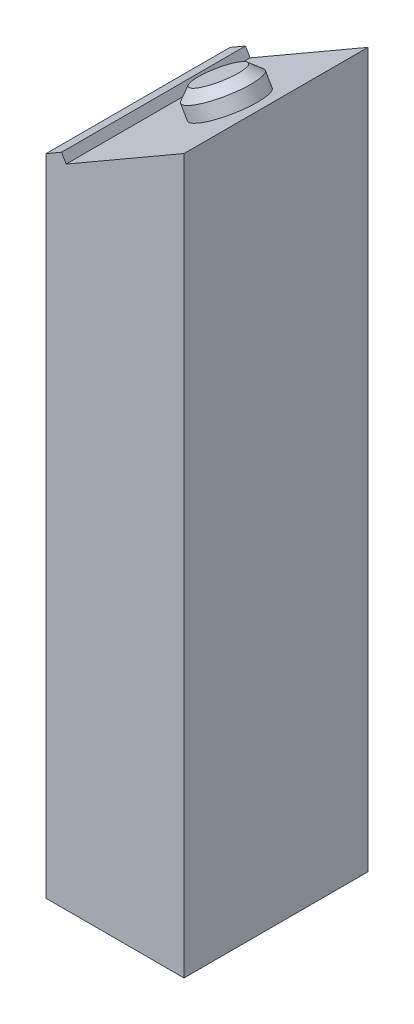
from build123d import *

# Parameters (mm, degrees)
EXTRUDE_1_DEPTH     = 9
SKETCH_2_R          = 3.5
CUT_EXTRUDE_1_DEPTH = 18
EXTRUDE_2_DEPTH     = 10
EXTRUDE_START       = 2.5
SKETCH_4_R          = 3.5
EXTRUDE_3_DEPTH     = 2.5
CHAMFER_1_SIZE      = 1
EXTRUDE_5_DEPTH     = 10
SKETCH_7_W          = 65.185315269
SKETCH_7_H          = 30.661532817
CUT_EXTRUDE_2_DEPTH = 10


with BuildPart() as part:
    # 草图1 → 凸台-拉伸1 (new, symmetric)
    with BuildSketch(Plane.XY):
        with BuildLine():
            Line((-38.810889132, -2.777568136), (-8.5, 14.722431864))
            ThreePointArc((-8.5, 14.722431864), (-1.481647627, 16.935309868), (5.814342437, 15.974774553))
            Line((5.814342437, 15.974774553), (6.498382723, 17.854159795))
            ThreePointArc((6.498382723, 17.854159795), (-1.655959112, 18.927699264), (-9.5, 16.454482672))
            Line((-9.5, 16.454482672), (-39.810889132, -1.045517328))
            Line((-39.810889132, -1.045517328), (-38.810889132, -2.777568136))
        make_face()
    extrude(amount=EXTRUDE_1_DEPTH, both=True)

    # 草图2 → 切除-拉伸1 (cut)
    with BuildSketch(Plane(origin=(-9.5, 16.454482672, 0), x_dir=(0.8660254037844398, 0.49999999999999806, 0), z_dir=(-0.49999999999999806, 0.8660254037844398, 0))):
        with Locations(Location((-26, 0, 0), (0, 0, 180))):
            Circle(SKETCH_2_R)
    extrude(amount=-CUT_EXTRUDE_1_DEPTH, mode=Mode.SUBTRACT)

    # 草图7 → 切除-拉伸2 (cut, symmetric)
    with BuildSketch(Plane.XY):
        with Locations((-14.546201846, 8.806087934)):
            Rectangle(SKETCH_7_W, SKETCH_7_H)
    extrude(amount=CUT_EXTRUDE_2_DEPTH, both=True, mode=Mode.SUBTRACT)


with BuildPart() as body_2:
    # 草图3 → 凸台-拉伸2 (new, symmetric)
    with BuildSketch(Plane.XY):
        Polygon((-26, 4.618802154), (-26, -73), (-41, -73), (-41, -4.041451884), align=None)
    extrude(amount=EXTRUDE_2_DEPTH, both=True)

    # 草图4 → 凸台-拉伸3 (add)
    with BuildSketch(Plane(origin=(-8.5, 14.722431864, 0), x_dir=(0.8660254037844386, 0.5000000000000001, 0), z_dir=(-0.5000000000000001, 0.8660254037844386, 0)).offset(EXTRUDE_START)):
        with Locations((-26, 0)):
            Circle(SKETCH_4_R)
    extrude(amount=-EXTRUDE_3_DEPTH)

    # 倒角1
    chamfer_1_edges = [body_2.edges().sort_by_distance(p)[0] for p in [
        (-35.297749412, 2.137495374, 0),
    ]]
    chamfer(chamfer_1_edges, length=CHAMFER_1_SIZE)

    # 草图6 → 凸台-拉伸5 (add, symmetric)
    with BuildSketch(Plane.XY):
        Polygon((-38.810889132, -2.777568136), (-39.310889132, -1.911542732), (-41, -2.886751346), (-41, -4.041451884), align=None)
    extrude(amount=EXTRUDE_5_DEPTH, both=True)


solid = body_2.part
